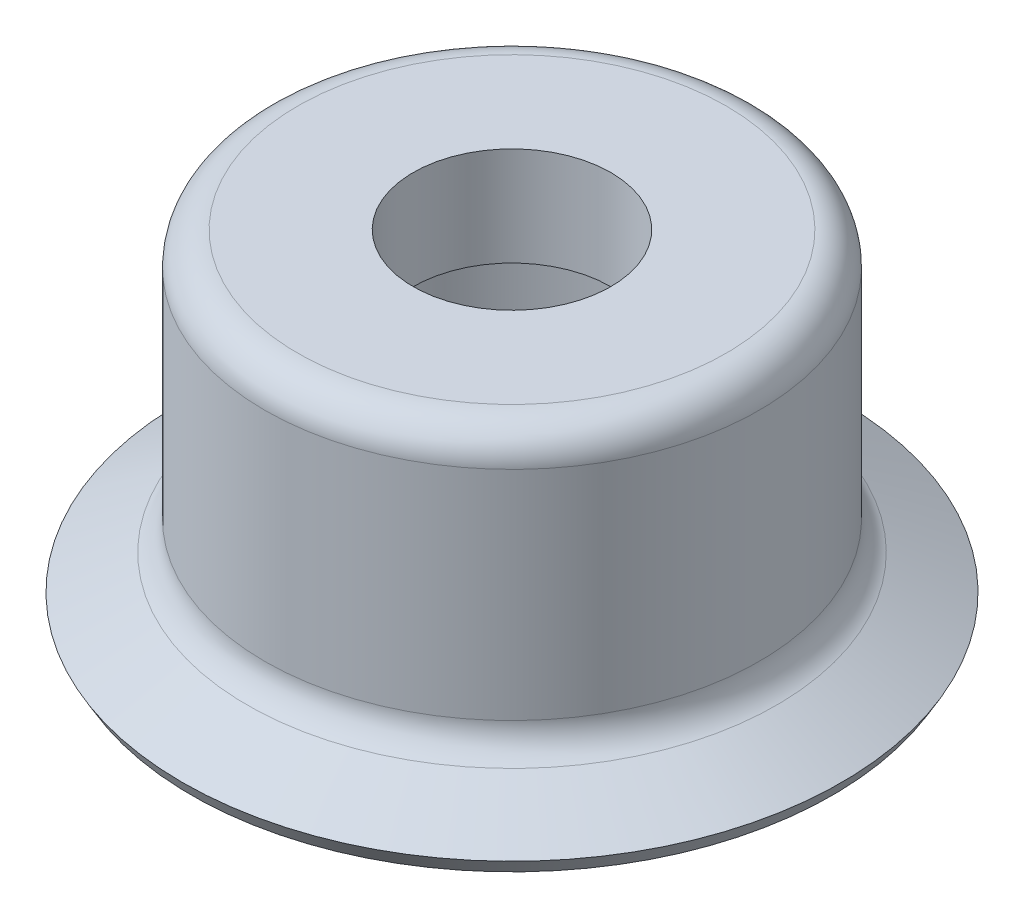
from build123d import *


with BuildPart() as part:
    # 草图1 → 旋转1 (revolve)
    with BuildSketch(Plane.XY, mode=Mode.PRIVATE) as revolve_1_sk:
        with BuildLine():
            Line((3, 7), (5, 7))
            Line((5, 7), (5, 1.5))
            Line((5, 1.5), (9.121216129, 0))
            Line((9.121216129, 0), (9.728225974, 0))
            Line((9.728225974, 0), (10, 0.470726421))
            Line((10, 0.470726421), (8.030528437, 1.517913026))
            ThreePointArc((8.030528437, 1.517913026), (7.642832699, 1.885822544), (7.5, 2.400860619))
            Line((7.5, 2.400860619), (7.5, 9))
            ThreePointArc((7.5, 9), (7.207106781, 9.707106781), (6.5, 10))
            Line((6.5, 10), (3, 10))
            Line((3, 10), (3, 7))
        make_face()
    revolve(revolve_1_sk.sketch.rotate(Axis((0, 10.001250003, 0), (0, -1, 0)), 270), axis=Axis((0, 10.001250003, 0), (0, -1, 0)))


solid = part.part
